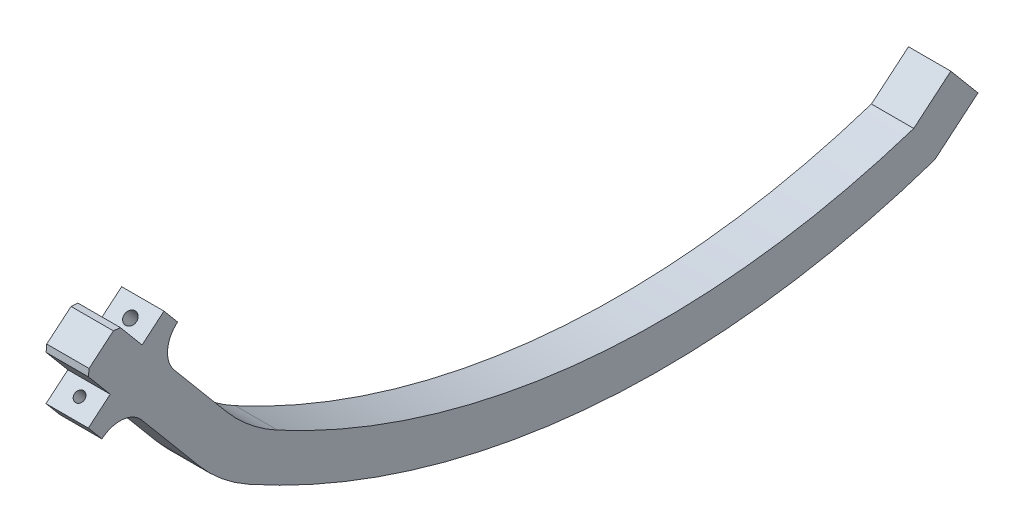
from build123d import *

# Parameters (mm, degrees)
AUFSATZ_LINEAR_AUSTRAGEN1_DEPTH  = 12
AUFSATZ_LINEAR_AUSTRAGEN3_DEPTH  = 12
AUFSATZ_LINEAR_AUSTRAGEN4_DEPTH  = 12
SCHNITT_LINEAR_AUSTRAGEN1_DEPTH  = 254.175024926
VERRUNDUNG1_R                    = 50
SKIZZE9_W                        = 12
SKIZZE9_H                        = 12
AUFSATZ_LINEAR_AUSTRAGEN6_DEPTH  = 11
AUFSATZ_LINEAR_AUSTRAGEN7_DEPTH  = 12
SKIZZE11_R                       = 1.75
SCHNITT_LINEAR_AUSTRAGEN3_DEPTH  = 10
SKIZZE12_R                       = 2.75
SCHNITT_LINEAR_AUSTRAGEN4_DEPTH  = 3.6
FASE1_SIZE                       = 1.5
SCHNITT_LINEAR_AUSTRAGEN8_DEPTH  = 254.549622303
SKIZZE11_3_R                     = 1.45
SCHNITT_LINEAR_AUSTRAGEN10_DEPTH = 6


with BuildPart() as part:
    # Skizze1 → Aufsatz-Linear austragen1 (new body)
    with BuildSketch(Plane(origin=(0, 0, 0), x_dir=(0, 0, -1), z_dir=(1, 0, 0))):
        with BuildLine():
            Line((-240, 65), (-230.735708163, 72.773663864))
            ThreePointArc((-230.735708163, 72.773663864), (-123.944567763, 17.242039243), (-3.735818811, 23.403668612))
            Line((-3.735818811, 23.403668612), (0, 12))
            ThreePointArc((0, 12), (-127.247502729, 5.681119716), (-240, 65))
        make_face()
    extrude(amount=AUFSATZ_LINEAR_AUSTRAGEN1_DEPTH)

    # Skizze4 → Aufsatz-Linear austragen3 (add)
    with BuildSketch(Plane(origin=(0, 0, 0), x_dir=(0, 0, -1), z_dir=(1, 0, 0))):
        with BuildLine():
            Line((-3.735818811, 23.403668612), (6.769031275, 32.218284445))
            Line((6.769031275, 32.218284445), (14.482482591, 23.025751128))
            Line((14.482482591, 23.025751128), (2.225771501, 12.741149373))
            ThreePointArc((2.225771501, 12.741149373), (1.113785782, 12.367871772), (0, 12))
            Line((0, 12), (-3.735818811, 23.403668612))
        make_face()
    extrude(amount=AUFSATZ_LINEAR_AUSTRAGEN3_DEPTH)

    # Skizze5 → Aufsatz-Linear austragen4 (add)
    with BuildSketch(Plane(origin=(12, 0, 0), x_dir=(0, 0, -1), z_dir=(1, 0, 0))):
        Polygon((-231.662517154, 71.995978781), (-222.469983836, 79.709430098), (-210.899806862, 65.920630121), (-192.948331238, 44.526894555), (-220.092340179, 58.207178805), align=None)
    extrude(amount=-AUFSATZ_LINEAR_AUSTRAGEN4_DEPTH)

    # Skizze6 → Schnitt-Linear austragen1 (cut, through all)
    with BuildSketch(Plane(origin=(12, 0, 0), x_dir=(0, 0, -1), z_dir=(1, 0, 0))):
        Polygon((-231.662517154, 71.995978781), (-199.510648028, 33.678873242), (-204.367668784, 29.603348917), (-240, 65), align=None)
    extrude(amount=-SCHNITT_LINEAR_AUSTRAGEN1_DEPTH, mode=Mode.SUBTRACT)

    # Verrundung1
    verrundung1_edges = [part.edges().sort_by_distance(p)[0] for p in [
        (6, 44.526894555, 192.948331238),
        (6, 35.285406895, 200.858689823),
    ]]
    fillet(verrundung1_edges, radius=VERRUNDUNG1_R)

    # Skizze9 → Aufsatz-Linear austragen6 (add)
    with BuildSketch(Plane(origin=(0, 156.320496136, 131.168470653), x_dir=(1, 0, 0), z_dir=(0, 0.7660444431189836, 0.6427876096865328))):
        with Locations((6, -125.185660837)):
            Rectangle(SKIZZE9_W, SKIZZE9_H)
    extrude(amount=AUFSATZ_LINEAR_AUSTRAGEN6_DEPTH)

    # Skizze10 → Aufsatz-Linear austragen7 (add)
    with BuildSketch(Plane.ZY):
        with BuildLine():
            Line((231.662517154, 71.995978781), (237.790872699, 66.853677904))
            Line((237.790872699, 66.853677904), (233.93414704, 62.257411245))
            ThreePointArc((233.93414704, 62.257411245), (228.094600221, 64.098613285), (222.663490618, 61.271356578))
            Line((222.663490618, 61.271356578), (231.662517154, 71.995978781))
        make_face()
        with BuildLine():
            Line((213.470957301, 68.984807894), (222.469983836, 79.709430098))
            Line((222.469983836, 79.709430098), (216.341628291, 84.851730975))
            Line((216.341628291, 84.851730975), (212.484902633, 80.255464316))
            ThreePointArc((212.484902633, 80.255464316), (215.31215934, 74.824354713), (213.470957301, 68.984807894))
        make_face()
    extrude(amount=-AUFSATZ_LINEAR_AUSTRAGEN7_DEPTH)

    # Skizze11 → Schnitt-Linear austragen3 (cut)
    with BuildSketch(Plane(origin=(0, 156.320496136, 131.168470653), x_dir=(1, 0, 0), z_dir=(0, 0.7660444431189826, 0.642787609686534))):
        with Locations(Location((6, -115.785660837, 0), (0, 0, 270))):
            Circle(SKIZZE11_R)
    extrude(amount=-SCHNITT_LINEAR_AUSTRAGEN3_DEPTH, mode=Mode.SUBTRACT)

    # Skizze12 → Schnitt-Linear austragen4 (cut)
    with BuildSketch(Plane(origin=(0, 148.660051704, 124.740594556), x_dir=(1, 0, 0), z_dir=(0, 0.7660444431189826, 0.642787609686534))):
        with Locations((6, -115.785660837)):
            Circle(SKIZZE12_R)
    extrude(amount=SCHNITT_LINEAR_AUSTRAGEN4_DEPTH, mode=Mode.SUBTRACT)

    # Fase1
    fase1_edges = [part.edges().sort_by_distance(p)[0] for p in [
        (6, 88.135918972, 229.540647543),
        (6, 80.422467656, 238.73318086),
    ]]
    chamfer(fase1_edges, length=FASE1_SIZE)

    # Skizze16 → Schnitt-Linear austragen8 (cut, through all)
    with BuildSketch(Plane(origin=(12, 0, 0), x_dir=(0, 0, -1), z_dir=(1, 0, 0))):
        Polygon((-222.469983836, 79.709430098), (-222.546588281, 79.645151337), (-228.717349334, 86.999177991), (-228.640744889, 87.063456752), align=None)
        Polygon((-237.833278207, 79.350005435), (-231.662517154, 71.995978781), (-231.585912709, 72.060257542), (-237.756673762, 79.414284196), align=None)
    extrude(amount=-SCHNITT_LINEAR_AUSTRAGEN8_DEPTH, mode=Mode.SUBTRACT)

    # Skizze11<3> → Schnitt-Linear austragen10 (cut)
    with BuildSketch(Plane(origin=(0, 156.320496136, 131.168470653), x_dir=(1, 0, 0), z_dir=(0, 0.7660444431189826, 0.642787609686534))):
        with Locations(Location((6, -134.585660837, 0), (0, 0, 270))):
            Circle(SKIZZE11_3_R)
    extrude(amount=-SCHNITT_LINEAR_AUSTRAGEN10_DEPTH, mode=Mode.SUBTRACT)


solid = part.part
